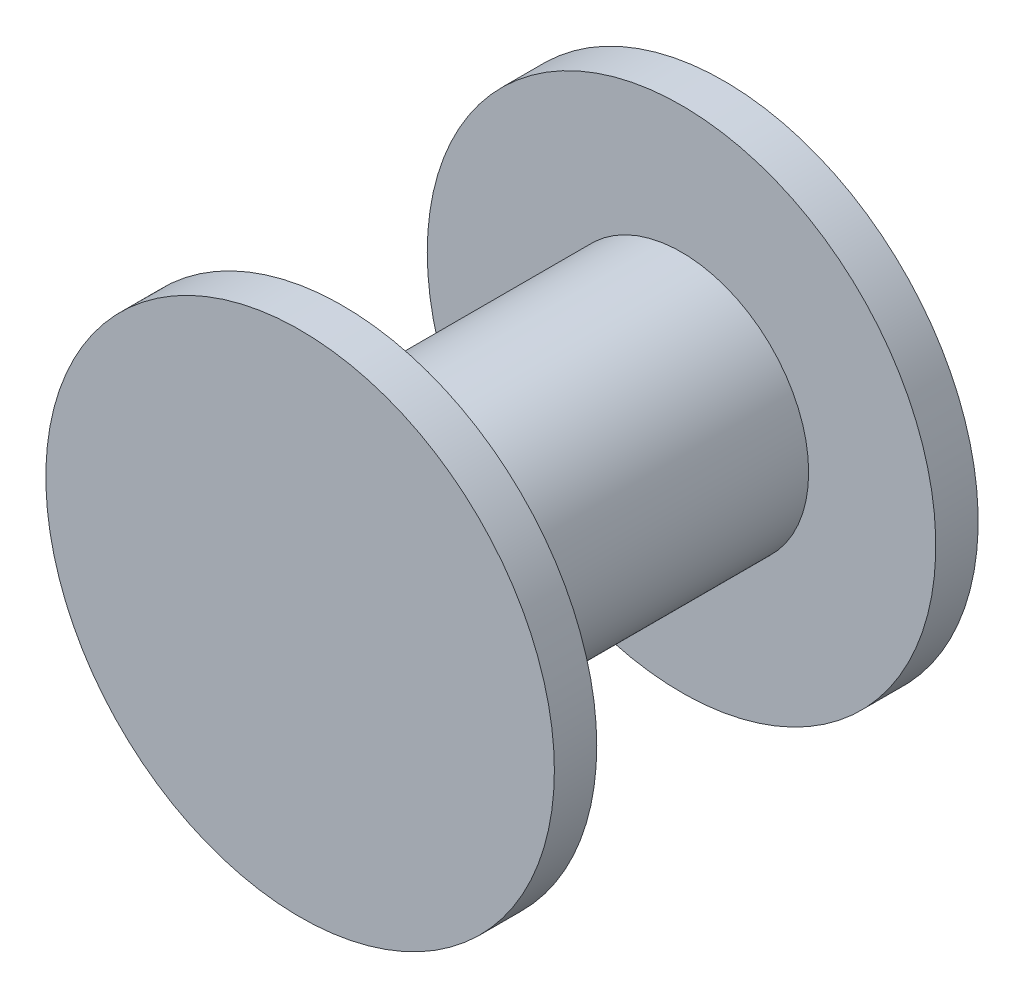
from build123d import *

# Parameters (mm, degrees)
SKETCH1_R           = 9.525
BOSS_EXTRUDE1_DEPTH = 25.4
SKETCH2_R           = 19.05
BOSS_EXTRUDE2_DEPTH = 3.175
SKETCH3_R           = 19.05
BOSS_EXTRUDE3_DEPTH = 3.175


with BuildPart() as part:
    # Sketch1 → Boss-Extrude1 (new body)
    with BuildSketch(Plane.XY):
        Circle(SKETCH1_R)
    extrude(amount=BOSS_EXTRUDE1_DEPTH)

    # Sketch2 → Boss-Extrude2 (add)
    with BuildSketch(Plane.XY.offset(25.4)):
        with Locations((0, -0.290363566)):
            Circle(SKETCH2_R)
    extrude(amount=BOSS_EXTRUDE2_DEPTH)

    # Sketch3 → Boss-Extrude3 (add)
    with BuildSketch(Plane(origin=(0, 0, 0), x_dir=(-1, 0, 0), z_dir=(0, 0, -1))):
        Circle(SKETCH3_R)
    extrude(amount=BOSS_EXTRUDE3_DEPTH)


solid = part.part
